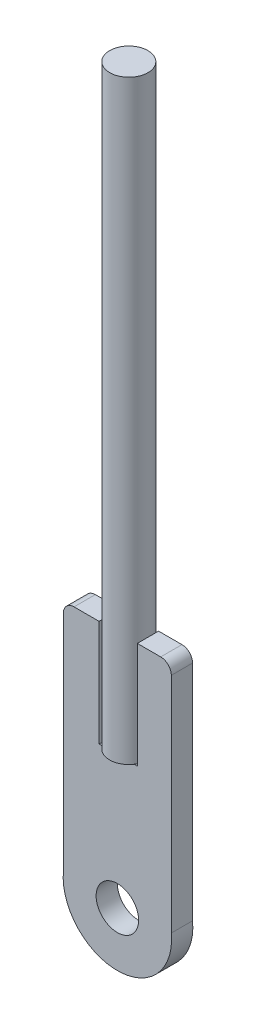
from build123d import *

# Parameters (mm, degrees)
SKETCH1_R           = 9
BOSS_EXTRUDE1_DEPTH = 280
SKETCH2_R           = 10
BOSS_EXTRUDE2_DEPTH = 5


with BuildPart() as part:
    # Sketch1 → Boss-Extrude1 (new body)
    with BuildSketch(Plane(origin=(0, 0, 0), x_dir=(1, 0, 0), z_dir=(0, 1, 0))):
        with Locations(Location((0, 0, 0), (0, 0, 270))):
            Circle(SKETCH1_R)
    extrude(amount=BOSS_EXTRUDE1_DEPTH)


with BuildPart() as body_2:
    # Sketch2 → Boss-Extrude2 (new, symmetric)
    with BuildSketch(Plane.XY):
        with BuildLine():
            Line((20, 50), (9, 50))
            Line((9, 50), (9, 0))
            Line((9, 0), (-9, 0))
            Line((-9, 0), (-9, 50))
            Line((-9, 50), (-20.763054614, 50))
            ThreePointArc((-20.763054614, 50), (-24.29858852, 48.535533906), (-25.763054614, 45))
            Line((-25.763054614, 45), (-25.763054614, -60))
            ThreePointArc((-25.763054614, -60), (-0.381527307, -88.004351167), (25, -60))
            Line((25, -60), (25, 45))
            ThreePointArc((25, 45), (23.535533906, 48.535533906), (20, 50))
        make_face()
        with Locations((-0.381527307, -62.5)):
            Circle(SKETCH2_R, mode=Mode.SUBTRACT)
    extrude(amount=BOSS_EXTRUDE2_DEPTH, both=True)


solid = Compound([part.part, body_2.part])
